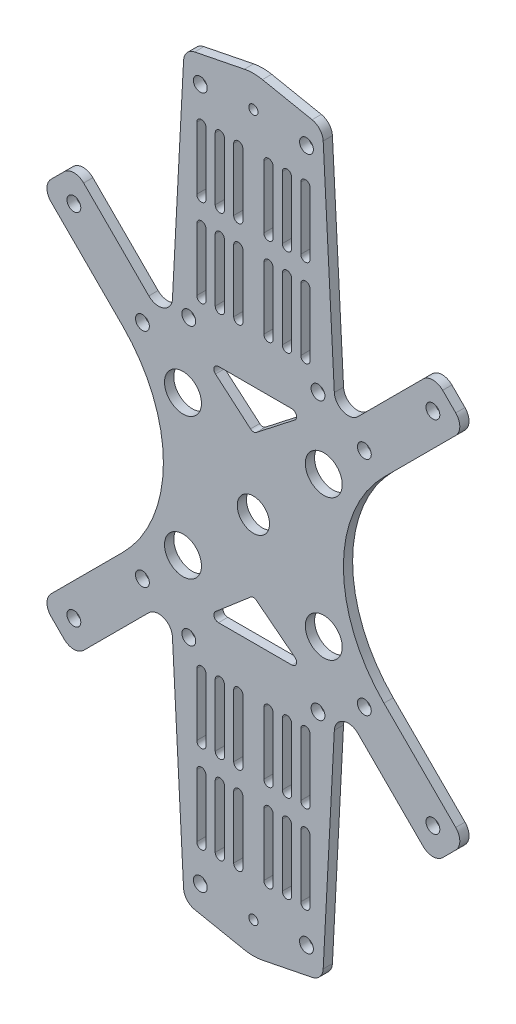
from build123d import *

# Parameters (mm, degrees)
CROQUIS1_R              = 4
CROQUIS1_R_2            = 1.5
CROQUIS1_R_3            = 3.5
CROQUIS1_R_4            = 1
SALIENTE_EXTRUIR1_DEPTH = 2
REDONDEO1_R             = 3
REDONDEO2_R             = 10


with BuildPart() as part:
    # Croquis1 → Saliente-Extruir1 (new body)
    with BuildSketch(Plane.XY):
        with BuildLine():
            Line((-42.426406871, 42.426406871), (-38.890872965, 45.961940777))
            Line((-38.890872965, 45.961940777), (-31.096194078, 38.16726189))
            Line((-31.096194078, 38.16726189), (-22.653119822, 29.724187634))
            ThreePointArc((-22.653119822, 29.724187634), (-19.456811617, 29.044722177), (-17.535923889, 31.688251973))
            Line((-17.535923889, 31.688251973), (-15, 80))
            Line((-15, 80), (0, 83))
            Line((0, 83), (15, 80))
            Line((15, 80), (17.535923889, 31.688251973))
            ThreePointArc((17.535923889, 31.688251973), (19.456811617, 29.044722177), (22.653119822, 29.724187634))
            Line((22.653119822, 29.724187634), (31.096194078, 38.16726189))
            Line((31.096194078, 38.16726189), (38.890872965, 45.961940777))
            Line((38.890872965, 45.961940777), (42.426406871, 42.426406871))
            Line((42.426406871, 42.426406871), (45.961940777, 38.890872965))
            Line((45.961940777, 38.890872965), (38.16726189, 31.096194078))
            Line((38.16726189, 31.096194078), (28.284271247, 21.213203436))
            ThreePointArc((28.284271247, 21.213203436), (19.497474683, 0), (28.284271247, -21.213203436))
            Line((28.284271247, -21.213203436), (38.16726189, -31.096194078))
            Line((38.16726189, -31.096194078), (45.961940777, -38.890872965))
            Line((45.961940777, -38.890872965), (42.426406871, -42.426406871))
            Line((42.426406871, -42.426406871), (38.890872965, -45.961940777))
            Line((38.890872965, -45.961940777), (31.096194078, -38.16726189))
            Line((31.096194078, -38.16726189), (22.653119822, -29.724187634))
            ThreePointArc((22.653119822, -29.724187634), (19.456811617, -29.044722177), (17.535923889, -31.688251973))
            Line((17.535923889, -31.688251973), (15, -80))
            Line((15, -80), (0, -83))
            Line((0, -83), (-15, -80))
            Line((-15, -80), (-17.535923889, -31.688251973))
            ThreePointArc((-17.535923889, -31.688251973), (-19.456811617, -29.044722177), (-22.653119822, -29.724187634))
            Line((-22.653119822, -29.724187634), (-31.096194078, -38.16726189))
            Line((-31.096194078, -38.16726189), (-38.890872965, -45.961940777))
            Line((-38.890872965, -45.961940777), (-42.426406871, -42.426406871))
            Line((-42.426406871, -42.426406871), (-45.961940777, -38.890872965))
            Line((-45.961940777, -38.890872965), (-38.16726189, -31.096194078))
            Line((-38.16726189, -31.096194078), (-28.284271247, -21.213203436))
            ThreePointArc((-28.284271247, -21.213203436), (-19.497474683, 0), (-28.284271247, 21.213203436))
            Line((-28.284271247, 21.213203436), (-38.16726189, 31.096194078))
            Line((-38.16726189, 31.096194078), (-45.961940777, 38.890872965))
            Line((-45.961940777, 38.890872965), (-42.426406871, 42.426406871))
        make_face()
        with Locations((-15.25, 15.25)):
            Circle(CROQUIS1_R, mode=Mode.SUBTRACT)
        with Locations((-24.04163056, 24.04163056)):
            Circle(CROQUIS1_R_2, mode=Mode.SUBTRACT)
        with Locations((-38.890872965, 38.890872965)):
            Circle(CROQUIS1_R_2, mode=Mode.SUBTRACT)
        with Locations(Location((38.890872965, 38.890872965, 0), (0, 0, 180))):
            Circle(CROQUIS1_R_2, mode=Mode.SUBTRACT)
        with Locations(Location((24.04163056, 24.04163056, 0), (0, 0, 180))):
            Circle(CROQUIS1_R_2, mode=Mode.SUBTRACT)
        with Locations(Location((15.25, 15.25, 0), (0, 0, 180))):
            Circle(CROQUIS1_R, mode=Mode.SUBTRACT)
        with Locations((15.25, -15.25)):
            Circle(CROQUIS1_R, mode=Mode.SUBTRACT)
        with Locations((24.04163056, -24.04163056)):
            Circle(CROQUIS1_R_2, mode=Mode.SUBTRACT)
        with Locations((38.890872965, -38.890872965)):
            Circle(CROQUIS1_R_2, mode=Mode.SUBTRACT)
        with Locations(Location((-15.25, -15.25, 0), (0, 0, 180))):
            Circle(CROQUIS1_R, mode=Mode.SUBTRACT)
        with Locations(Location((-24.04163056, -24.04163056, 0), (0, 0, 180))):
            Circle(CROQUIS1_R_2, mode=Mode.SUBTRACT)
        with Locations(Location((-38.890872965, -38.890872965, 0), (0, 0, 180))):
            Circle(CROQUIS1_R_2, mode=Mode.SUBTRACT)
        Circle(CROQUIS1_R_3, mode=Mode.SUBTRACT)
        with Locations((-11.5, -75)):
            Circle(CROQUIS1_R_2, mode=Mode.SUBTRACT)
        with Locations(Location((-14, 30, 0), (0, 0, 180))):
            Circle(CROQUIS1_R_2, mode=Mode.SUBTRACT)
        with Locations(Location((11.5, -75, 0), (0, 0, 180))):
            Circle(CROQUIS1_R_2, mode=Mode.SUBTRACT)
        with Locations((11.5, 75)):
            Circle(CROQUIS1_R_2, mode=Mode.SUBTRACT)
        with Locations(Location((-11.5, 75, 0), (0, 0, 180))):
            Circle(CROQUIS1_R_2, mode=Mode.SUBTRACT)
        with Locations((14, 30)):
            Circle(CROQUIS1_R_2, mode=Mode.SUBTRACT)
        with Locations(Location((14, -30, 0), (0, 0, 180))):
            Circle(CROQUIS1_R_2, mode=Mode.SUBTRACT)
        with Locations((-14, -30)):
            Circle(CROQUIS1_R_2, mode=Mode.SUBTRACT)
        with Locations((0, 76)):
            Circle(CROQUIS1_R_4, mode=Mode.SUBTRACT)
        with Locations(Location((0, -76, 0), (0, 0, 180))):
            Circle(CROQUIS1_R_4, mode=Mode.SUBTRACT)
        with BuildLine():
            Line((-12.267961944, -54), (-12.267961944, -67.5))
            ThreePointArc((-12.267961944, -67.5), (-11.267961944, -68.5), (-10.267961944, -67.5))
            Line((-10.267961944, -67.5), (-10.267961944, -54))
            ThreePointArc((-10.267961944, -54), (-11.267961944, -53), (-12.267961944, -54))
        make_face(mode=Mode.SUBTRACT)
        with BuildLine():
            Line((-8.267961944, -54), (-8.267961944, -67.5))
            ThreePointArc((-8.267961944, -67.5), (-7.267961944, -68.5), (-6.267961944, -67.5))
            Line((-6.267961944, -67.5), (-6.267961944, -54))
            ThreePointArc((-6.267961944, -54), (-7.267961944, -53), (-8.267961944, -54))
        make_face(mode=Mode.SUBTRACT)
        with BuildLine():
            Line((-4.267961944, -54), (-4.267961944, -67.5))
            ThreePointArc((-4.267961944, -67.5), (-3.267961944, -68.5), (-2.267961944, -67.5))
            Line((-2.267961944, -67.5), (-2.267961944, -54))
            ThreePointArc((-2.267961944, -54), (-3.267961944, -53), (-4.267961944, -54))
        make_face(mode=Mode.SUBTRACT)
        with BuildLine():
            Line((-8.267961944, -35), (-8.267961944, -48.5))
            ThreePointArc((-8.267961944, -48.5), (-7.267961944, -49.5), (-6.267961944, -48.5))
            Line((-6.267961944, -48.5), (-6.267961944, -35))
            ThreePointArc((-6.267961944, -35), (-7.267961944, -34), (-8.267961944, -35))
        make_face(mode=Mode.SUBTRACT)
        with BuildLine():
            Line((-4.267961944, -35), (-4.267961944, -48.5))
            ThreePointArc((-4.267961944, -48.5), (-3.267961944, -49.5), (-2.267961944, -48.5))
            Line((-2.267961944, -48.5), (-2.267961944, -35))
            ThreePointArc((-2.267961944, -35), (-3.267961944, -34), (-4.267961944, -35))
        make_face(mode=Mode.SUBTRACT)
        with BuildLine():
            Line((-12.267961944, -35), (-12.267961944, -48.5))
            ThreePointArc((-12.267961944, -48.5), (-11.267961944, -49.5), (-10.267961944, -48.5))
            Line((-10.267961944, -48.5), (-10.267961944, -35))
            ThreePointArc((-10.267961944, -35), (-11.267961944, -34), (-12.267961944, -35))
        make_face(mode=Mode.SUBTRACT)
        with BuildLine():
            Line((10.267961944, -35), (10.267961944, -48.5))
            ThreePointArc((10.267961944, -48.5), (11.267961944, -49.5), (12.267961944, -48.5))
            Line((12.267961944, -48.5), (12.267961944, -35))
            ThreePointArc((12.267961944, -35), (11.267961944, -34), (10.267961944, -35))
        make_face(mode=Mode.SUBTRACT)
        with BuildLine():
            Line((2.267961944, -35), (2.267961944, -48.5))
            ThreePointArc((2.267961944, -48.5), (3.267961944, -49.5), (4.267961944, -48.5))
            Line((4.267961944, -48.5), (4.267961944, -35))
            ThreePointArc((4.267961944, -35), (3.267961944, -34), (2.267961944, -35))
        make_face(mode=Mode.SUBTRACT)
        with BuildLine():
            Line((6.267961944, -35), (6.267961944, -48.5))
            ThreePointArc((6.267961944, -48.5), (7.267961944, -49.5), (8.267961944, -48.5))
            Line((8.267961944, -48.5), (8.267961944, -35))
            ThreePointArc((8.267961944, -35), (7.267961944, -34), (6.267961944, -35))
        make_face(mode=Mode.SUBTRACT)
        with BuildLine():
            Line((2.267961944, -54), (2.267961944, -67.5))
            ThreePointArc((2.267961944, -67.5), (3.267961944, -68.5), (4.267961944, -67.5))
            Line((4.267961944, -67.5), (4.267961944, -54))
            ThreePointArc((4.267961944, -54), (3.267961944, -53), (2.267961944, -54))
        make_face(mode=Mode.SUBTRACT)
        with BuildLine():
            Line((6.267961944, -54), (6.267961944, -67.5))
            ThreePointArc((6.267961944, -67.5), (7.267961944, -68.5), (8.267961944, -67.5))
            Line((8.267961944, -67.5), (8.267961944, -54))
            ThreePointArc((8.267961944, -54), (7.267961944, -53), (6.267961944, -54))
        make_face(mode=Mode.SUBTRACT)
        with BuildLine():
            Line((10.267961944, -54), (10.267961944, -67.5))
            ThreePointArc((10.267961944, -67.5), (11.267961944, -68.5), (12.267961944, -67.5))
            Line((12.267961944, -67.5), (12.267961944, -54))
            ThreePointArc((12.267961944, -54), (11.267961944, -53), (10.267961944, -54))
        make_face(mode=Mode.SUBTRACT)
        with BuildLine():
            Line((12.267961944, 54), (12.267961944, 67.5))
            ThreePointArc((12.267961944, 67.5), (11.267961944, 68.5), (10.267961944, 67.5))
            Line((10.267961944, 67.5), (10.267961944, 54))
            ThreePointArc((10.267961944, 54), (11.267961944, 53), (12.267961944, 54))
        make_face(mode=Mode.SUBTRACT)
        with BuildLine():
            Line((8.267961944, 54), (8.267961944, 67.5))
            ThreePointArc((8.267961944, 67.5), (7.267961944, 68.5), (6.267961944, 67.5))
            Line((6.267961944, 67.5), (6.267961944, 54))
            ThreePointArc((6.267961944, 54), (7.267961944, 53), (8.267961944, 54))
        make_face(mode=Mode.SUBTRACT)
        with BuildLine():
            Line((4.267961944, 54), (4.267961944, 67.5))
            ThreePointArc((4.267961944, 67.5), (3.267961944, 68.5), (2.267961944, 67.5))
            Line((2.267961944, 67.5), (2.267961944, 54))
            ThreePointArc((2.267961944, 54), (3.267961944, 53), (4.267961944, 54))
        make_face(mode=Mode.SUBTRACT)
        with BuildLine():
            Line((8.267961944, 35), (8.267961944, 48.5))
            ThreePointArc((8.267961944, 48.5), (7.267961944, 49.5), (6.267961944, 48.5))
            Line((6.267961944, 48.5), (6.267961944, 35))
            ThreePointArc((6.267961944, 35), (7.267961944, 34), (8.267961944, 35))
        make_face(mode=Mode.SUBTRACT)
        with BuildLine():
            Line((4.267961944, 35), (4.267961944, 48.5))
            ThreePointArc((4.267961944, 48.5), (3.267961944, 49.5), (2.267961944, 48.5))
            Line((2.267961944, 48.5), (2.267961944, 35))
            ThreePointArc((2.267961944, 35), (3.267961944, 34), (4.267961944, 35))
        make_face(mode=Mode.SUBTRACT)
        with BuildLine():
            Line((12.267961944, 35), (12.267961944, 48.5))
            ThreePointArc((12.267961944, 48.5), (11.267961944, 49.5), (10.267961944, 48.5))
            Line((10.267961944, 48.5), (10.267961944, 35))
            ThreePointArc((10.267961944, 35), (11.267961944, 34), (12.267961944, 35))
        make_face(mode=Mode.SUBTRACT)
        with BuildLine():
            Line((-10.267961944, 35), (-10.267961944, 48.5))
            ThreePointArc((-10.267961944, 48.5), (-11.267961944, 49.5), (-12.267961944, 48.5))
            Line((-12.267961944, 48.5), (-12.267961944, 35))
            ThreePointArc((-12.267961944, 35), (-11.267961944, 34), (-10.267961944, 35))
        make_face(mode=Mode.SUBTRACT)
        with BuildLine():
            Line((-2.267961944, 35), (-2.267961944, 48.5))
            ThreePointArc((-2.267961944, 48.5), (-3.267961944, 49.5), (-4.267961944, 48.5))
            Line((-4.267961944, 48.5), (-4.267961944, 35))
            ThreePointArc((-4.267961944, 35), (-3.267961944, 34), (-2.267961944, 35))
        make_face(mode=Mode.SUBTRACT)
        with BuildLine():
            Line((-6.267961944, 35), (-6.267961944, 48.5))
            ThreePointArc((-6.267961944, 48.5), (-7.267961944, 49.5), (-8.267961944, 48.5))
            Line((-8.267961944, 48.5), (-8.267961944, 35))
            ThreePointArc((-8.267961944, 35), (-7.267961944, 34), (-6.267961944, 35))
        make_face(mode=Mode.SUBTRACT)
        with BuildLine():
            Line((-2.267961944, 54), (-2.267961944, 67.5))
            ThreePointArc((-2.267961944, 67.5), (-3.267961944, 68.5), (-4.267961944, 67.5))
            Line((-4.267961944, 67.5), (-4.267961944, 54))
            ThreePointArc((-4.267961944, 54), (-3.267961944, 53), (-2.267961944, 54))
        make_face(mode=Mode.SUBTRACT)
        with BuildLine():
            Line((-6.267961944, 54), (-6.267961944, 67.5))
            ThreePointArc((-6.267961944, 67.5), (-7.267961944, 68.5), (-8.267961944, 67.5))
            Line((-8.267961944, 67.5), (-8.267961944, 54))
            ThreePointArc((-8.267961944, 54), (-7.267961944, 53), (-6.267961944, 54))
        make_face(mode=Mode.SUBTRACT)
        with BuildLine():
            Line((-10.267961944, 54), (-10.267961944, 67.5))
            ThreePointArc((-10.267961944, 67.5), (-11.267961944, 68.5), (-12.267961944, 67.5))
            Line((-12.267961944, 67.5), (-12.267961944, 54))
            ThreePointArc((-12.267961944, 54), (-11.267961944, 53), (-10.267961944, 54))
        make_face(mode=Mode.SUBTRACT)
        with BuildLine():
            Line((-0.620989881, -15.781703725), (-8.212878231, -22.282027547))
            ThreePointArc((-8.212878231, -22.282027547), (-8.50046857, -23.388327104), (-7.562491222, -24.04163056))
            Line((-7.562491222, -24.04163056), (8.360661842, -24.04163056))
            ThreePointArc((8.360661842, -24.04163056), (9.30628687, -23.36688939), (8.975807622, -22.253217173))
            Line((8.975807622, -22.253217173), (0.644542909, -15.75289335))
            ThreePointArc((0.644542909, -15.75289335), (0.006637615, -15.541565769), (-0.620989881, -15.781703725))
        make_face(mode=Mode.SUBTRACT)
        with BuildLine():
            Line((-7.562491222, 24.04163056), (8.360661842, 24.04163056))
            ThreePointArc((8.360661842, 24.04163056), (9.30628687, 23.36688939), (8.975807622, 22.253217173))
            Line((8.975807622, 22.253217173), (0.644542909, 15.75289335))
            ThreePointArc((0.644542909, 15.75289335), (0.006637615, 15.541565769), (-0.620989881, 15.781703725))
            Line((-0.620989881, 15.781703725), (-8.212878231, 22.282027547))
            ThreePointArc((-8.212878231, 22.282027547), (-8.50046857, 23.388327104), (-7.562491222, 24.04163056))
        make_face(mode=Mode.SUBTRACT)
    extrude(amount=SALIENTE_EXTRUIR1_DEPTH)

    # Redondeo1
    redondeo1_edges = [part.edges().sort_by_distance(p)[0] for p in [
        (-38.890872965, 45.961940777, 1),
        (-15, 80, 1),
        (15, 80, 1),
        (38.890872965, 45.961940777, 1),
        (45.961940777, 38.890872965, 1),
        (45.961940777, -38.890872965, 1),
        (38.890872965, -45.961940777, 1),
        (15, -80, 1),
        (-15, -80, 1),
        (-38.890872965, -45.961940777, 1),
        (-45.961940777, -38.890872965, 1),
        (-45.961940777, 38.890872965, 1),
    ]]
    fillet(redondeo1_edges, radius=REDONDEO1_R)

    # Redondeo2
    redondeo2_edges = [part.edges().sort_by_distance(p)[0] for p in [
        (0, 83, 1),
        (0, -83, 1),
    ]]
    fillet(redondeo2_edges, radius=REDONDEO2_R)


solid = part.part
